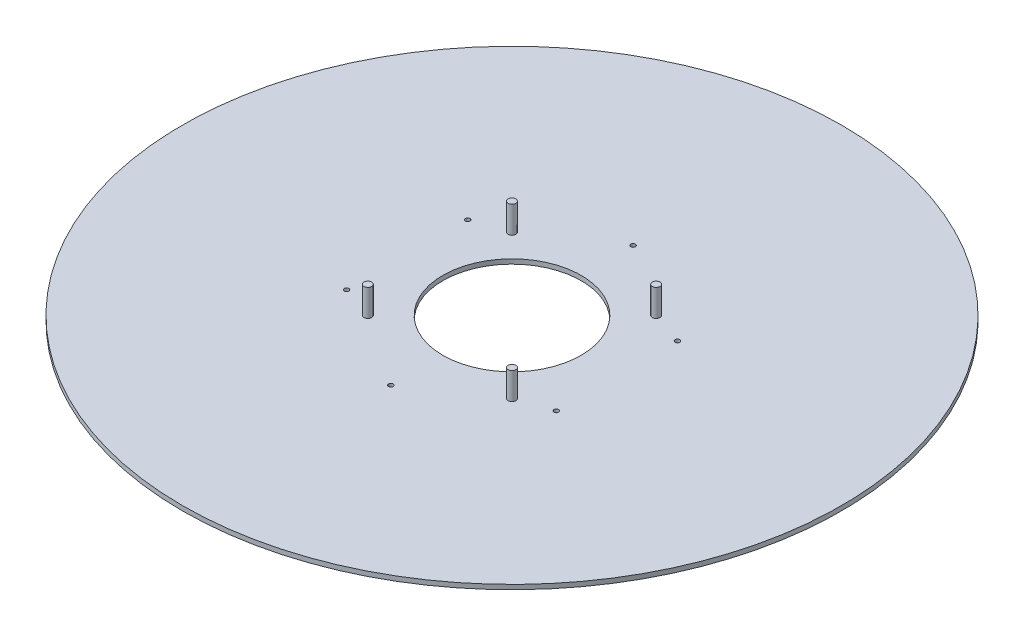
from build123d import *

# Parameters (mm, degrees)
SKETCH1_R           = 428.5
SKETCH1_R_2         = 90
BOSS_EXTRUDE1_DEPTH = 6
SKETCH2_R           = 3
CUT_EXTRUDE1_DEPTH  = 6
SKETCH5_R           = 5
BOSS_EXTRUDE2_DEPTH = 35
CIRPATTERN1_COUNT   = 6
CIRPATTERN2_COUNT   = 4


with BuildPart() as part:
    # Sketch1 → Boss-Extrude1 (new body)
    with BuildSketch(Plane(origin=(0, 0, 0), x_dir=(1, 0, 0), z_dir=(0, 1, 0))):
        with Locations(Location((0, 0, 0), (0, 0, 270))):
            Circle(SKETCH1_R)
        with Locations(Location((0, 0, 0), (0, 0, 270))):
            Circle(SKETCH1_R_2, mode=Mode.SUBTRACT)
    extrude(amount=BOSS_EXTRUDE1_DEPTH)

    # Sketch2 → Cut-Extrude1 (cut)
    with BuildSketch(Plane(origin=(0, 6, 0), x_dir=(1, 0, 0), z_dir=(0, 1, 0))):
        with Locations(Location((0, 157.5, 0), (0, 0, 270))):
            Circle(SKETCH2_R)
    cut_extrude1 = extrude(amount=-CUT_EXTRUDE1_DEPTH, mode=Mode.SUBTRACT)

    # Sketch5 → Boss-Extrude2 (add)
    with BuildSketch(Plane(origin=(0, 6, 0), x_dir=(1, 0, 0), z_dir=(0, 1, 0))):
        with Locations(Location((93.691648507, 93.691648507, 0), (0, 0, 270))):
            Circle(SKETCH5_R)
    boss_extrude2 = extrude(amount=BOSS_EXTRUDE2_DEPTH)

    # CirPattern1: Cut-Extrude1 ×6 about axis
    cirpattern1_axis = Axis((0, 0, 0), (0, 1, 0))
    for i in range(1, CIRPATTERN1_COUNT):
        add(cut_extrude1.rotate(cirpattern1_axis, i * 360 / CIRPATTERN1_COUNT), mode=Mode.SUBTRACT)

    # CirPattern2: Boss-Extrude2 ×4 about axis
    cirpattern2_axis = Axis((0, 0, 0), (0, 1, 0))
    for i in range(1, CIRPATTERN2_COUNT):
        add(boss_extrude2.rotate(cirpattern2_axis, i * 360 / CIRPATTERN2_COUNT))


solid = part.part
